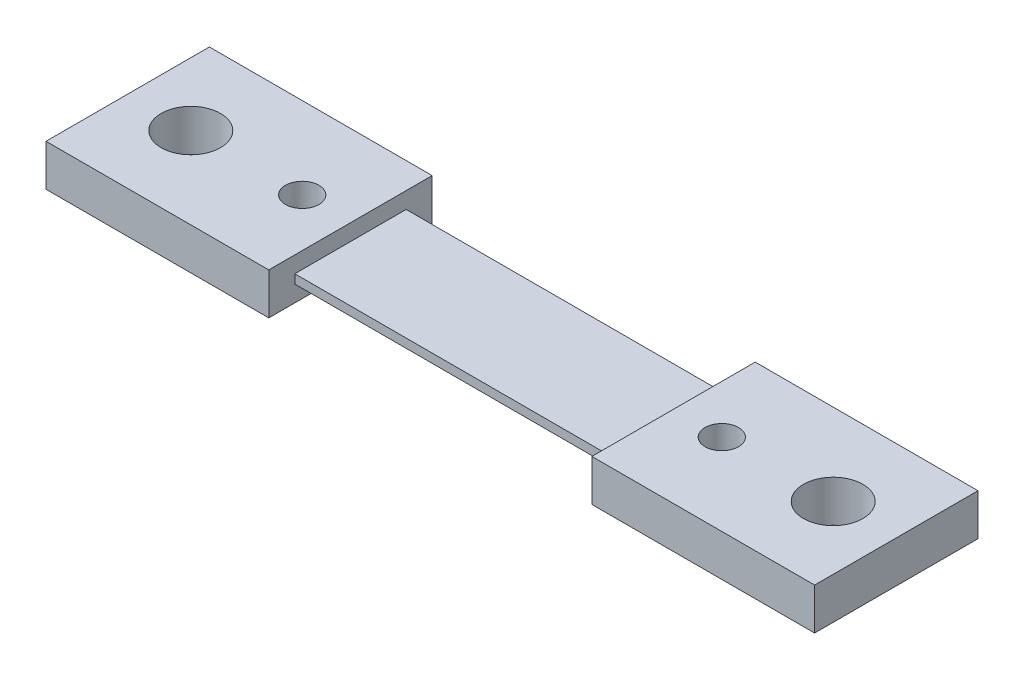
from build123d import *

# Parameters (mm, degrees)
BOSS_EXTRUDE1_DEPTH      = 0.6
BOSS_EXTRUDE1_DEPTH_BACK = 0.6
SKETCH2_W                = 43.5
SKETCH2_H                = 15
BOSS_EXTRUDE2_DEPTH      = 2.8
BOSS_EXTRUDE2_DEPTH_BACK = 2.8
SKETCH3_W                = 30
SKETCH3_H                = 22
CUT_EXTRUDE1_DEPTH       = 53.980208569
CUT_EXTRUDE1_DEPTH_BACK  = 53.980208569
SKETCH4_R                = 2.25
SKETCH4_R_2              = 4


with BuildPart() as part:
    # Sketch2 → Boss-Extrude1 (new, two sides: drawn at the far end of the back side and taken through both)
    with BuildSketch(Plane(origin=(0, 0, 0), x_dir=(1, 0, 0), z_dir=(0, 1, 0)).offset(-BOSS_EXTRUDE1_DEPTH_BACK)):
        Rectangle(SKETCH2_W, SKETCH2_H)
    extrude(amount=BOSS_EXTRUDE1_DEPTH + BOSS_EXTRUDE1_DEPTH_BACK)

    # Sketch3 → Boss-Extrude2 (add, two sides: drawn at the far end of the back side and taken through both)
    with BuildSketch(Plane(origin=(0, 0, 0), x_dir=(1, 0, 0), z_dir=(0, 1, 0)).offset(-BOSS_EXTRUDE2_DEPTH_BACK)):
        with Locations((36.75, 0)):
            Rectangle(SKETCH3_W, SKETCH3_H)
        with Locations((-36.75, 0)):
            Rectangle(SKETCH3_W, SKETCH3_H)
    extrude(amount=BOSS_EXTRUDE2_DEPTH + BOSS_EXTRUDE2_DEPTH_BACK)

    # Sketch4 → Cut-Extrude1 (cut, two sides: drawn at the far end of the back side and taken through both)
    with BuildSketch(Plane(origin=(0, 0, 0), x_dir=(1, 0, 0), z_dir=(0, 1, 0)).offset(-CUT_EXTRUDE1_DEPTH_BACK)):
        with Locations((28.25, 0)):
            Circle(SKETCH4_R)
        with Locations((43.25, 0)):
            Circle(SKETCH4_R_2)
        with Locations((-43.25, 0)):
            Circle(SKETCH4_R_2)
        with Locations((-28.25, 0)):
            Circle(SKETCH4_R)
    extrude(amount=CUT_EXTRUDE1_DEPTH + CUT_EXTRUDE1_DEPTH_BACK, mode=Mode.SUBTRACT)


solid = part.part
